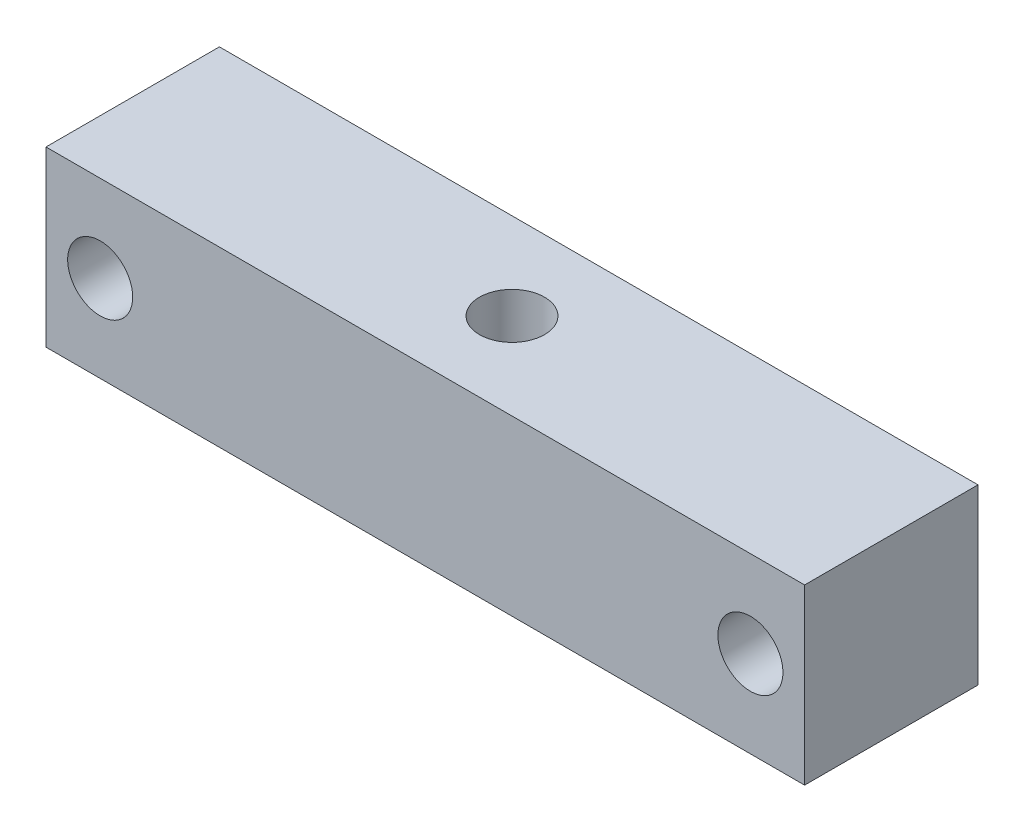
from build123d import *

# Parameters (mm, degrees)
SKETCH_1_W          = 35
SKETCH_1_H          = 8
EXTRUDE_2_DEPTH     = 8
SKETCH_3_R          = 1.5
CUT_EXTRUDE_1_DEPTH = 8
SKETCH_4_R          = 1.5
CUT_EXTRUDE_2_DEPTH = 8


with BuildPart() as part:
    # 草图1 → 凸台-拉伸2 (new body)
    with BuildSketch(Plane.XY):
        Rectangle(SKETCH_1_W, SKETCH_1_H)
    extrude(amount=EXTRUDE_2_DEPTH)

    # 草图3 → 切除-拉伸1 (cut)
    with BuildSketch(Plane(origin=(0, 0, 0), x_dir=(-1, 0, 0), z_dir=(0, 0, -1))):
        with Locations((-15, 0)):
            Circle(SKETCH_3_R)
        with Locations(Location((15, 0, 0), (0, 0, 180))):
            Circle(SKETCH_3_R)
    extrude(amount=-CUT_EXTRUDE_1_DEPTH, mode=Mode.SUBTRACT)

    # 草图4 → 切除-拉伸2 (cut)
    with BuildSketch(Plane(origin=(0, 4, 0), x_dir=(1, 0, 0), z_dir=(0, 1, 0))):
        with Locations(Location((0, -4, 0), (0, 0, 270))):
            Circle(SKETCH_4_R)
    extrude(amount=-CUT_EXTRUDE_2_DEPTH, mode=Mode.SUBTRACT)


solid = part.part
